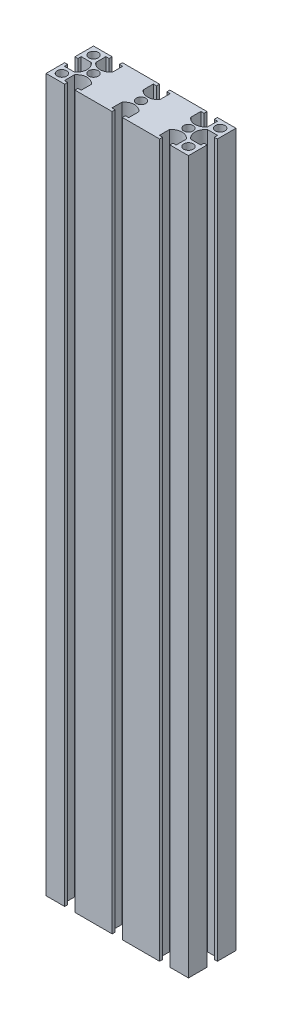
from build123d import *

# Parameters (mm, degrees)
SKETCH_1_R      = 3
EXTRUDE_1_DEPTH = 450


with BuildPart() as part:
    # 草图1 → 凸台-拉伸1 (new body)
    with BuildSketch(Plane(origin=(0, 0, 0), x_dir=(1, 0, 0), z_dir=(0, 1, 0))):
        with BuildLine():
            Line((-33.25, 15), (-45, 15))
            Line((-45, 15), (-45, 3.25))
            Line((-45, 3.25), (-43.1, 3.25))
            Line((-43.1, 3.25), (-43.1, 5.3))
            Line((-43.1, 5.3), (-36.746672245, 5.3))
            ThreePointArc((-36.746672245, 5.3), (-34.1, 0), (-36.746672245, -5.3))
            Line((-36.746672245, -5.3), (-43.1, -5.3))
            Line((-43.1, -5.3), (-43.1, -3.25))
            Line((-43.1, -3.25), (-45, -3.25))
            Line((-45, -3.25), (-45, -15))
            Line((-45, -15), (-33.25, -15))
            Line((-33.25, -15), (-33.25, -13.1))
            Line((-33.25, -13.1), (-35.3, -13.1))
            Line((-35.3, -13.1), (-35.3, -6.746672245))
            ThreePointArc((-35.3, -6.746672245), (-30, -4.1), (-24.7, -6.746672245))
            Line((-24.7, -6.746672245), (-24.7, -13.1))
            Line((-24.7, -13.1), (-26.75, -13.1))
            Line((-26.75, -13.1), (-26.75, -15))
            Line((-26.75, -15), (-3.25, -15))
            Line((-3.25, -15), (-3.25, -13.1))
            Line((-3.25, -13.1), (-5.3, -13.1))
            Line((-5.3, -13.1), (-5.3, -6.746672245))
            ThreePointArc((-5.3, -6.746672245), (0, -4.1), (5.3, -6.746672245))
            Line((5.3, -6.746672245), (5.3, -13.1))
            Line((5.3, -13.1), (3.25, -13.1))
            Line((3.25, -13.1), (3.25, -15))
            Line((3.25, -15), (26.75, -15))
            Line((26.75, -15), (26.75, -13.1))
            Line((26.75, -13.1), (24.7, -13.1))
            Line((24.7, -13.1), (24.7, -6.746672245))
            ThreePointArc((24.7, -6.746672245), (30, -4.1), (35.3, -6.746672245))
            Line((35.3, -6.746672245), (35.3, -13.1))
            Line((35.3, -13.1), (33.25, -13.1))
            Line((33.25, -13.1), (33.25, -15))
            Line((33.25, -15), (45, -15))
            Line((45, -15), (45, -3.25))
            Line((45, -3.25), (43.1, -3.25))
            Line((43.1, -3.25), (43.1, -5.3))
            Line((43.1, -5.3), (36.746672245, -5.3))
            ThreePointArc((36.746672245, -5.3), (34.1, 0), (36.746672245, 5.3))
            Line((36.746672245, 5.3), (43.1, 5.3))
            Line((43.1, 5.3), (43.1, 3.25))
            Line((43.1, 3.25), (45, 3.25))
            Line((45, 3.25), (45, 15))
            Line((45, 15), (33.25, 15))
            Line((33.25, 15), (33.25, 13.1))
            Line((33.25, 13.1), (35.3, 13.1))
            Line((35.3, 13.1), (35.3, 6.746672245))
            ThreePointArc((35.3, 6.746672245), (30, 4.1), (24.7, 6.746672245))
            Line((24.7, 6.746672245), (24.7, 13.1))
            Line((24.7, 13.1), (26.75, 13.1))
            Line((26.75, 13.1), (26.75, 15))
            Line((26.75, 15), (3.25, 15))
            Line((3.25, 15), (3.25, 13.1))
            Line((3.25, 13.1), (5.3, 13.1))
            Line((5.3, 13.1), (5.3, 6.746672245))
            ThreePointArc((5.3, 6.746672245), (0, 4.1), (-5.3, 6.746672245))
            Line((-5.3, 6.746672245), (-5.3, 13.1))
            Line((-5.3, 13.1), (-3.25, 13.1))
            Line((-3.25, 13.1), (-3.25, 15))
            Line((-3.25, 15), (-26.75, 15))
            Line((-26.75, 15), (-26.75, 13.1))
            Line((-26.75, 13.1), (-24.7, 13.1))
            Line((-24.7, 13.1), (-24.7, 6.746672245))
            ThreePointArc((-24.7, 6.746672245), (-30, 4.1), (-35.3, 6.746672245))
            Line((-35.3, 6.746672245), (-35.3, 13.1))
            Line((-35.3, 13.1), (-33.25, 13.1))
            Line((-33.25, 13.1), (-33.25, 15))
        make_face()
        with Locations(Location((-40, -10, 0), (0, 0, 270))):
            Circle(SKETCH_1_R, mode=Mode.SUBTRACT)
        with Locations(Location((-30, 0, 0), (0, 0, 270))):
            Circle(SKETCH_1_R, mode=Mode.SUBTRACT)
        with Locations(Location((0, 0, 0), (0, 0, 270))):
            Circle(SKETCH_1_R, mode=Mode.SUBTRACT)
        with Locations(Location((40, -10, 0), (0, 0, 270))):
            Circle(SKETCH_1_R, mode=Mode.SUBTRACT)
        with Locations(Location((-40, 10, 0), (0, 0, 270))):
            Circle(SKETCH_1_R, mode=Mode.SUBTRACT)
        with Locations(Location((30, 0, 0), (0, 0, 270))):
            Circle(SKETCH_1_R, mode=Mode.SUBTRACT)
        with Locations(Location((40, 10, 0), (0, 0, 270))):
            Circle(SKETCH_1_R, mode=Mode.SUBTRACT)
    extrude(amount=EXTRUDE_1_DEPTH)


solid = part.part
